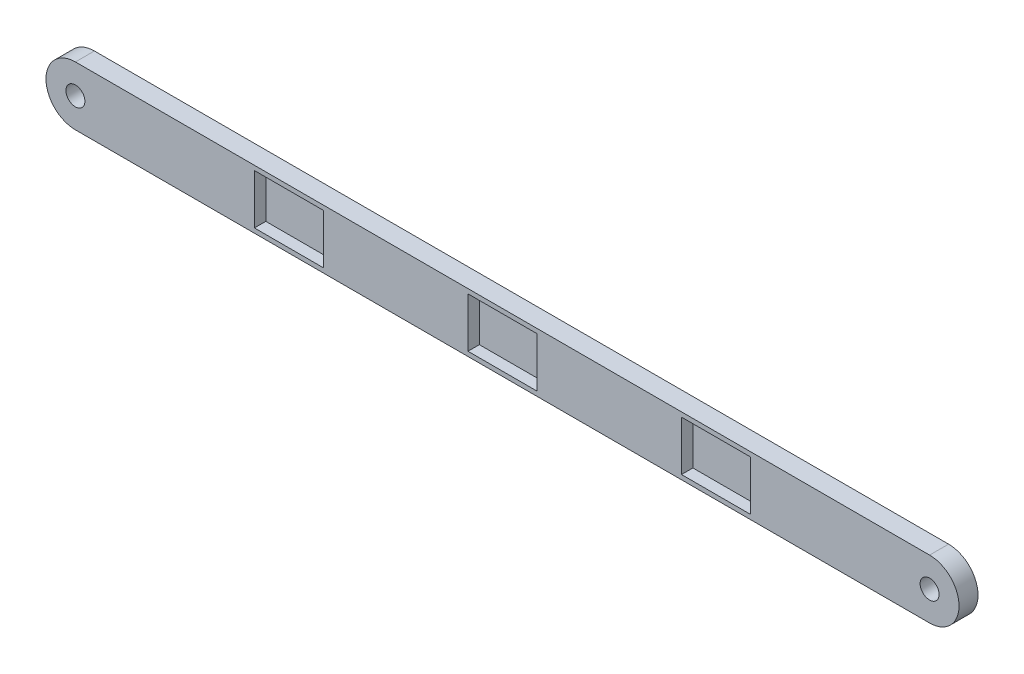
from build123d import *

# Parameters (mm, degrees)
CROQUIS1_R              = 2.5
SALIENTE_EXTRUIR1_DEPTH = 2.5
CROQUIS4_W              = 18.2
CROQUIS4_H              = 13.1
CORTAR_EXTRUIR4_DEPTH   = 3


with BuildPart() as part:
    # Croquis1 → Saliente-Extruir1 (new, symmetric)
    with BuildSketch(Plane.XY):
        with BuildLine():
            Line((-112.5, 7.75), (112.5, 7.75))
            ThreePointArc((112.5, 7.75), (120.25, 0), (112.5, -7.75))
            Line((112.5, -7.75), (-112.5, -7.75))
            ThreePointArc((-112.5, -7.75), (-120.25, 0), (-112.5, 7.75))
        make_face()
        with Locations((112.5, 0)):
            Circle(CROQUIS1_R, mode=Mode.SUBTRACT)
        with Locations((-112.5, 0)):
            Circle(CROQUIS1_R, mode=Mode.SUBTRACT)
    extrude(amount=SALIENTE_EXTRUIR1_DEPTH, both=True)

    # Croquis4 → Cortar-Extruir4 (cut)
    with BuildSketch(Plane.XY.offset(2.5)):
        Rectangle(CROQUIS4_W, CROQUIS4_H)
        with Locations((-56.25, 0)):
            Rectangle(CROQUIS4_W, CROQUIS4_H)
        with Locations((56.25, 0)):
            Rectangle(CROQUIS4_W, CROQUIS4_H)
    extrude(amount=-CORTAR_EXTRUIR4_DEPTH, mode=Mode.SUBTRACT)


solid = part.part
